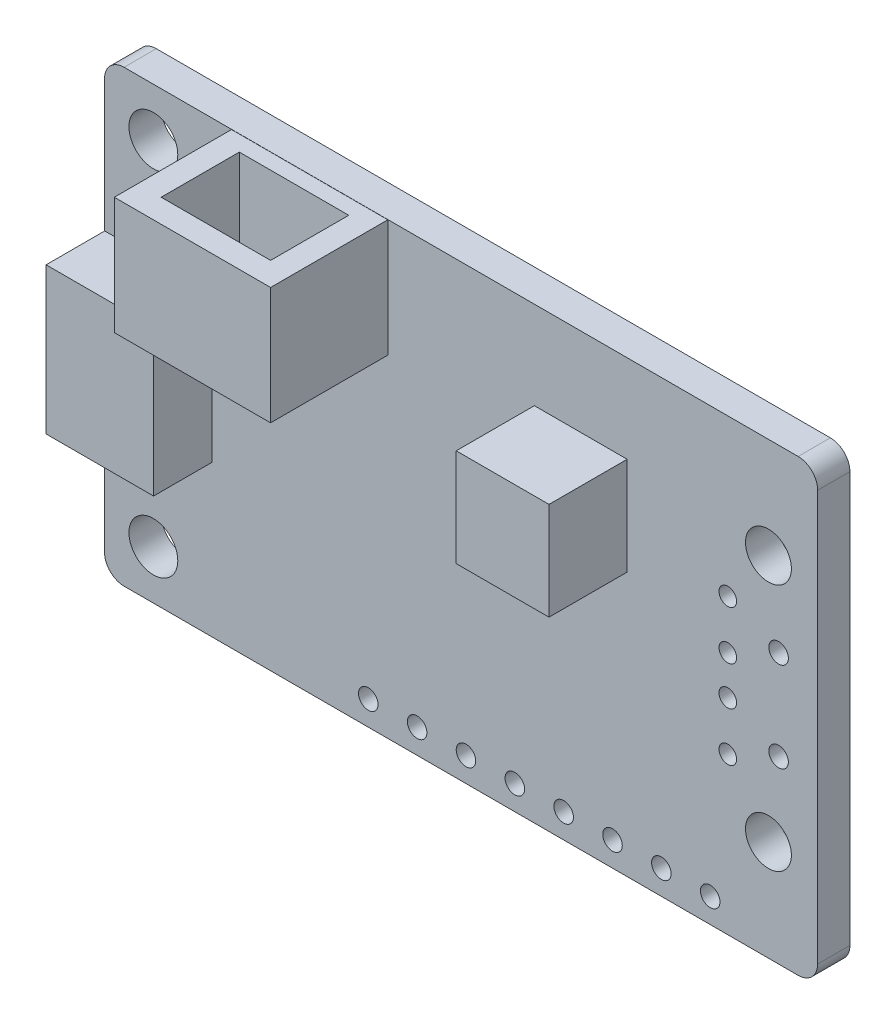
from build123d import *

# Parameters (mm, degrees)
BASE_DEPTH          = 1.65
SKETCH2_R           = 1.25
CUT_EXTRUDE1_DEPTH  = 22.634116575
SKETCH3_R           = 0.5
CUT_EXTRUDE2_DEPTH  = 22.634116575
LPATTERN1_COUNT     = 8
LPATTERN1_PITCH     = 2.5
SKETCH4_R           = 1.175
CUT_EXTRUDE3_DEPTH  = 22.634116575
SKETCH9_R           = 0.45
CUT_EXTRUDE6_DEPTH  = 22.634116575
SKETCH10_R          = 0.5
CUT_EXTRUDE7_DEPTH  = 22.634116575
SKETCH5_W           = 8
SKETCH5_H           = 6
BOSS_EXTRUDE2_DEPTH = 6
SKETCH6_W           = 5.6
SKETCH6_H           = 4
CUT_EXTRUDE4_DEPTH  = 4.8
SKETCH7_W           = 5.5
SKETCH7_H           = 7.5
BOSS_EXTRUDE3_DEPTH = 3
SKETCH8_W           = 2
SKETCH8_H           = 6.5
CUT_EXTRUDE5_DEPTH  = 5
SKETCH11_W          = 4.75
SKETCH11_H          = 5
BOSS_EXTRUDE4_DEPTH = 4


with BuildPart() as part:
    # Sketch1 → Base (new body)
    with BuildSketch(Plane.XY):
        with BuildLine():
            Line((-17.25, -11.5), (17.25, -11.5))
            ThreePointArc((17.25, -11.5), (17.957106781, -11.207106781), (18.25, -10.5))
            Line((18.25, -10.5), (18.25, 10.5))
            ThreePointArc((18.25, 10.5), (17.957106781, 11.207106781), (17.25, 11.5))
            Line((17.25, 11.5), (-17.25, 11.5))
            ThreePointArc((-17.25, 11.5), (-17.957106781, 11.207106781), (-18.25, 10.5))
            Line((-18.25, 10.5), (-18.25, -10.5))
            ThreePointArc((-18.25, -10.5), (-17.957106781, -11.207106781), (-17.25, -11.5))
        make_face()
    extrude(amount=BASE_DEPTH)

    # Sketch2 → Cut-Extrude1 (cut, through all)
    with BuildSketch(Plane.XY.offset(1.65)):
        with Locations((-15.75, 9)):
            Circle(SKETCH2_R)
    cut_extrude1 = extrude(amount=-CUT_EXTRUDE1_DEPTH, mode=Mode.SUBTRACT)

    # Mirror1: Cut-Extrude1 across plane
    add(cut_extrude1.mirror(Plane.ZX), mode=Mode.SUBTRACT)

    # Sketch3 → Cut-Extrude2 (cut, through all)
    with BuildSketch(Plane.XY.offset(1.65)):
        with Locations((12.75, -10.25)):
            Circle(SKETCH3_R)
    cut_extrude2 = extrude(amount=-CUT_EXTRUDE2_DEPTH, mode=Mode.SUBTRACT)

    # LPattern1: Cut-Extrude2 ×8
    with Locations(*[(-i * LPATTERN1_PITCH, 0, 0) for i in range(1, LPATTERN1_COUNT)]):
        add(cut_extrude2, mode=Mode.SUBTRACT)

    # Sketch4 → Cut-Extrude3 (cut, through all)
    with BuildSketch(Plane.XY.offset(1.65)):
        with Locations((15.730877355, -6.3475)):
            Circle(SKETCH4_R)
    cut_extrude3 = extrude(amount=-CUT_EXTRUDE3_DEPTH, mode=Mode.SUBTRACT)

    # Sketch9 → Cut-Extrude6 (cut, through all)
    with BuildSketch(Plane.XY.offset(1.65)):
        with Locations((13.65, 1)):
            Circle(SKETCH9_R)
        with Locations((13.65, 3.5)):
            Circle(SKETCH9_R)
    cut_extrude6 = extrude(amount=-CUT_EXTRUDE6_DEPTH, mode=Mode.SUBTRACT)

    # Sketch10 → Cut-Extrude7 (cut, through all)
    with BuildSketch(Plane.XY.offset(1.65)):
        with Locations((16.25, 2.3)):
            Circle(SKETCH10_R)
    cut_extrude7 = extrude(amount=-CUT_EXTRUDE7_DEPTH, mode=Mode.SUBTRACT)

    # Mirror2: Cut-Extrude3 across plane
    add(cut_extrude3.mirror(Plane.ZX), mode=Mode.SUBTRACT)

    # Mirror3: Cut-Extrude6 across plane
    add(cut_extrude6.mirror(Plane.ZX), mode=Mode.SUBTRACT)

    # Mirror4: Cut-Extrude7 across plane
    add(cut_extrude7.mirror(Plane.ZX), mode=Mode.SUBTRACT)

    # Sketch5 → Boss-Extrude2 (add)
    with BuildSketch(Plane.XY.offset(1.65)):
        with Locations((-7.75, 8.49)):
            Rectangle(SKETCH5_W, SKETCH5_H)
    extrude(amount=BOSS_EXTRUDE2_DEPTH)

    # Sketch6 → Cut-Extrude4 (cut)
    with BuildSketch(Plane(origin=(0, 11.5, 0), x_dir=(1, 0, 0), z_dir=(0, 1, 0))):
        with Locations((-7.75, -4.45)):
            Rectangle(SKETCH6_W, SKETCH6_H)
    extrude(amount=-CUT_EXTRUDE4_DEPTH, mode=Mode.SUBTRACT)

    # Sketch7 → Boss-Extrude3 (add)
    with BuildSketch(Plane.XY.offset(1.65)):
        with Locations((-15.49, 0)):
            Rectangle(SKETCH7_W, SKETCH7_H)
    extrude(amount=BOSS_EXTRUDE3_DEPTH)

    # Sketch8 → Cut-Extrude5 (cut)
    with BuildSketch(Plane.ZY.offset(18.24)):
        with Locations((3.15, 0)):
            Rectangle(SKETCH8_W, SKETCH8_H)
    extrude(amount=-CUT_EXTRUDE5_DEPTH, mode=Mode.SUBTRACT)

    # Sketch11 → Boss-Extrude4 (add)
    with BuildSketch(Plane.XY.offset(1.65)):
        with Locations((6.125, 4.5)):
            Rectangle(SKETCH11_W, SKETCH11_H)
    extrude(amount=BOSS_EXTRUDE4_DEPTH)


solid = part.part
